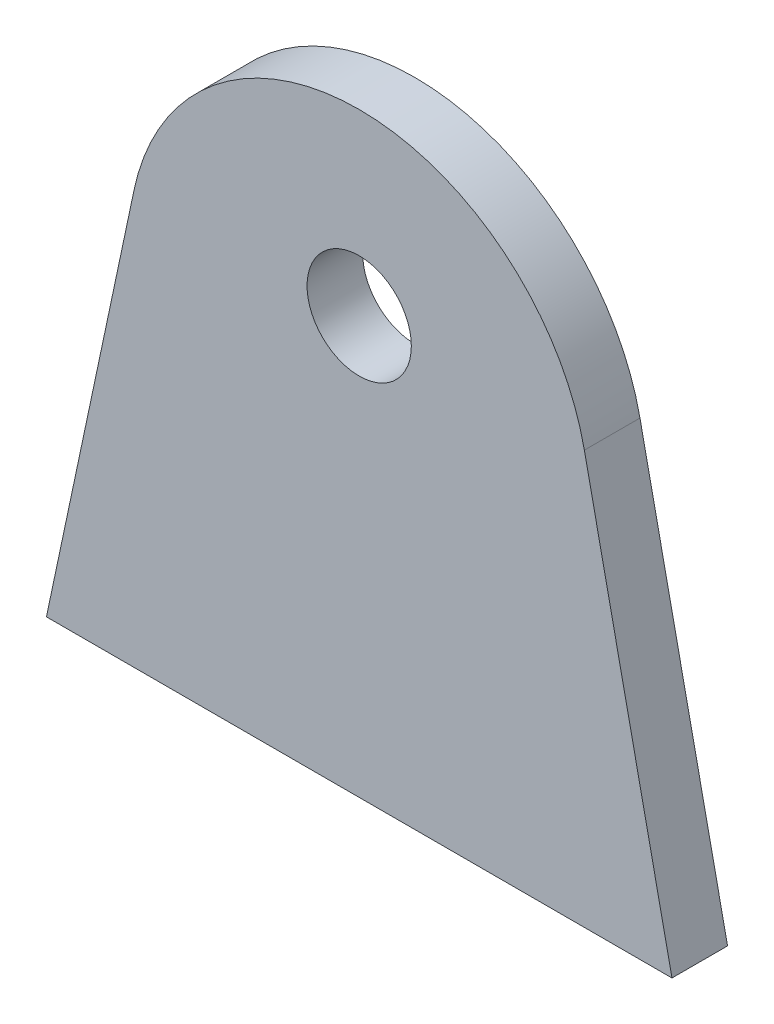
from build123d import *

# Parameters (mm, degrees)
SKETCH1_R           = 2.38125
BOSS_EXTRUDE1_DEPTH = 2.54


with BuildPart() as part:
    # Sketch1 → Boss-Extrude1 (new body)
    with BuildSketch(Plane.XY):
        with BuildLine():
            Line((0, 0), (28.575, 0))
            Line((28.575, 0), (24.573234041, 18.881830476))
            ThreePointArc((24.573234041, 18.881830476), (14.2875, 27.2161), (4.001765959, 18.881830476))
            Line((4.001765959, 18.881830476), (0, 0))
        make_face()
        with Locations((14.2875, 19.05)):
            Circle(SKETCH1_R, mode=Mode.SUBTRACT)
    extrude(amount=-BOSS_EXTRUDE1_DEPTH)


solid = part.part
